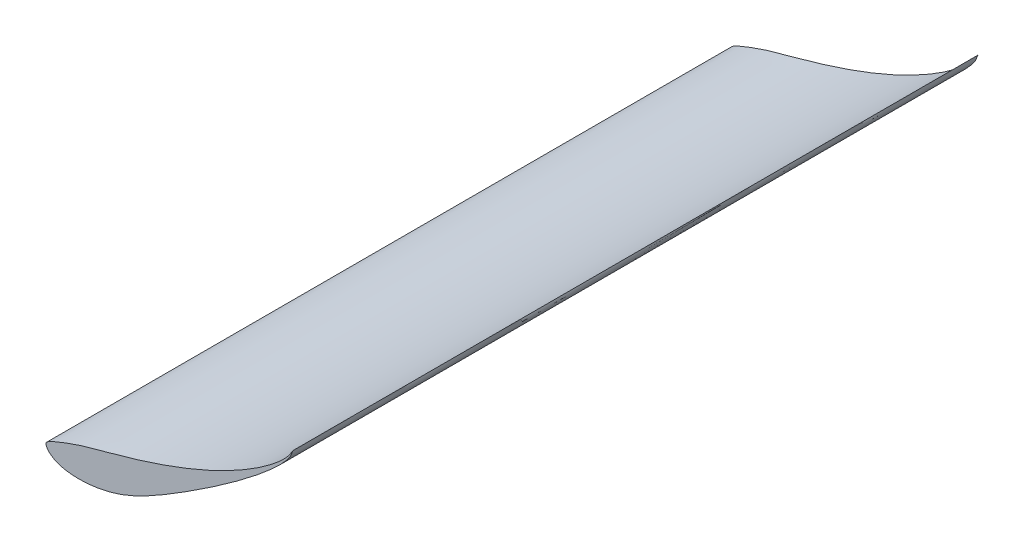
from build123d import *

# Parameters (mm, degrees)
BOSS_EXTRUDE1_DEPTH = 225


with BuildPart() as part:
    # Sketch4 → Boss-Extrude1 (new, symmetric)
    with BuildSketch(Plane.XY):
        with BuildLine():
            add(Edge.make_bspline(
                [(161.782928334, 78.906806422), (161.785905611, 78.903160267), (161.447333121, 78.247507626), (161.212790739, 77.586809996), (160.663662421, 76.177919428), (159.963686697, 74.622645836), (158.834096282, 72.847989117), (157.297142207, 70.912444803), (155.365226619, 68.732533649), (153.035247673, 66.323975957), (150.316872975, 63.700473734), (147.222429639, 60.879306118), (143.769714101, 57.875310471), (139.975887074, 54.708976697), (135.861918867, 51.400058873), (131.452183111, 47.968579605), (126.774094995, 44.434493991), (121.851807555, 40.824994136), (116.71863597, 37.158055883), (111.400902448, 33.461497453), (105.936655775, 29.7517228), (100.360291373, 26.053786286), (94.713757074, 22.391277301), (89.047588775, 18.782411105), (83.403047369, 15.26864086), (77.822950062, 11.885088093), (72.333696975, 8.681887585), (66.956753807, 5.697616604), (61.706522027, 2.980682397), (56.623089762, 0.517955958), (51.669344781, -1.590435287), (46.833655736, -3.325394691), (42.120066935, -4.742637194), (37.526587527, -5.840755485), (33.082431282, -6.668842863), (28.813516387, -7.237982293), (24.749402999, -7.569136699), (20.914788835, -7.6591059), (17.333963198, -7.532188363), (14.030785254, -7.198051405), (11.03154894, -6.670229825), (8.353792854, -5.982363646), (6.016381032, -5.103487398), (4.033538617, -4.044146806), (2.381877582, -2.878261946), (1.083660744, -1.639642652), (0.135766851, -0.374288757), (-0.388381138, 0.831268733), (-0.612510819, 2.062110653), (0.255014697, 3.150495005), (1.737060364, 3.966671402), (3.779158606, 5.053129359), (6.447018051, 6.214854192), (9.666546535, 7.528806639), (13.417776779, 8.9478404), (17.66031419, 10.461554119), (22.379234967, 12.050748727), (27.622176028, 13.612249314), (33.400778515, 15.182129805), (39.685282986, 16.888485925), (46.434045735, 18.745377858), (53.584765043, 20.781968827), (61.067668501, 23.018684679), (68.810432321, 25.467432508), (76.731648542, 28.137209995), (84.750619007, 31.023414451), (92.777279952, 34.128130392), (100.725974603, 37.430672647), (108.507071588, 40.91004536), (116.030704418, 44.539688342), (123.212042913, 48.28093667), (129.969981169, 52.08864491), (136.223432896, 55.916663084), (141.90606393, 59.702774186), (146.950282394, 63.384574293), (151.30742348, 66.897416085), (154.914276771, 70.141520438), (157.720496904, 73.095045026), (159.596742999, 75.460482505), (160.872984322, 77.423971854), (161.361767915, 78.181322041), (161.779890528, 78.910526703), (161.782928334, 78.906806422)],
                knots=[0, 0, 0, 0, 0.000979678, 0.003648862, 0.007483499, 0.012095277, 0.017525591, 0.02405178, 0.031783051, 0.040677828, 0.050710301, 0.061833229, 0.07398925, 0.087118173, 0.101145049, 0.115990637, 0.131570422, 0.147788379, 0.164550917, 0.181757895, 0.199311955, 0.217095072, 0.234990228, 0.252856883, 0.270540594, 0.287886779, 0.304773438, 0.321101419, 0.336806063, 0.351800033, 0.366031063, 0.379615675, 0.392652963, 0.405170359, 0.417171919, 0.428603517, 0.439418959, 0.449596586, 0.459102079, 0.467907878, 0.475988301, 0.483308969, 0.489874508, 0.49580325, 0.501149412, 0.505903073, 0.510046769, 0.513579311, 0.516446927, 0.519350053, 0.523823355, 0.529973794, 0.537715654, 0.546967844, 0.557637367, 0.569620481, 0.582804124, 0.597246961, 0.613135037, 0.6304436, 0.649056124, 0.668822257, 0.689594964, 0.711189651, 0.733426689, 0.756094118, 0.778988554, 0.801889683, 0.824566598, 0.846792285, 0.868338291, 0.888978163, 0.908492011, 0.926658768, 0.943286193, 0.95816921, 0.971135822, 0.981955623, 0.990251791, 0.995852565, 0.999000406, 1, 1, 1, 1], degree=3))
        make_face()
    extrude(amount=BOSS_EXTRUDE1_DEPTH, both=True)


solid = part.part
